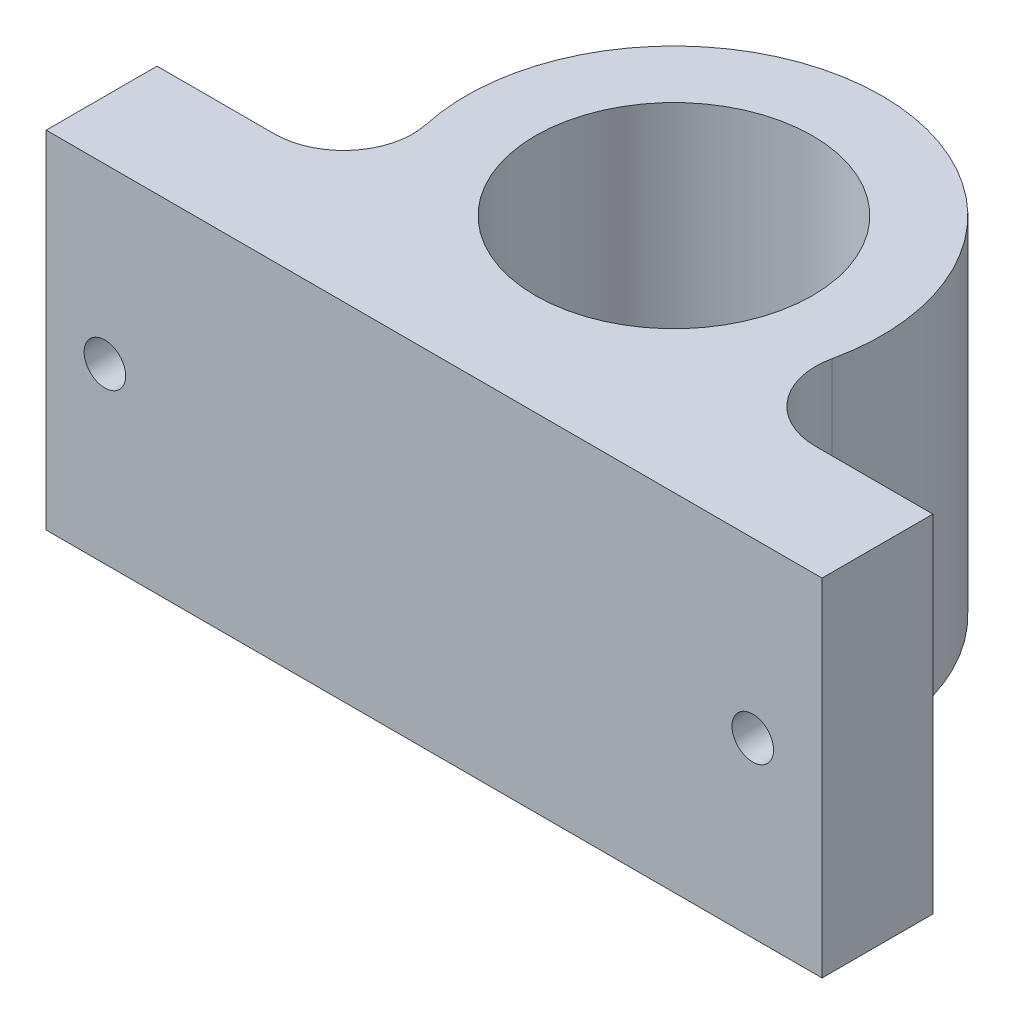
from build123d import *

# Parameters (mm, degrees)
SKETCH1_R                 = 10
BOSS_EXTRUDE1_DEPTH       = 25
FILLET2_R                 = 5
FILLET3_R                 = 5
F_3_0MM_DOWEL_HOLE1_D     = 3
F_3_0MM_DOWEL_HOLE1_DEPTH = 12.4
F_3_0MM_DOWEL_HOLE1_TIP   = 0.901290929


with BuildPart() as part:
    # Sketch1 → Boss-Extrude1 (new body)
    with BuildSketch(Plane(origin=(0, 0, 0), x_dir=(1, 0, 0), z_dir=(0, 1, 0))):
        with BuildLine():
            Line((0, 0), (-28, 0))
            Line((-28, 0), (-28, 8))
            Line((-28, 8), (-11.761010247, 8))
            ThreePointArc((-11.761010247, 8), (0, 32.310136302), (11.761010247, 8))
            Line((11.761010247, 8), (28, 8))
            Line((28, 8), (28, 0))
            Line((28, 0), (0, 0))
        make_face()
        with Locations(Location((0, 17.310136302, 0), (0, 0, 270))):
            Circle(SKETCH1_R, mode=Mode.SUBTRACT)
    extrude(amount=BOSS_EXTRUDE1_DEPTH)

    # Fillet2
    fillet2_edges = [part.edges().sort_by_distance(p)[0] for p in [
        (11.761010247, 12.5, -8),
    ]]
    fillet(fillet2_edges, radius=FILLET2_R)

    # Fillet3
    fillet3_edges = [part.edges().sort_by_distance(p)[0] for p in [
        (-11.761010247, 12.5, -8),
    ]]
    fillet(fillet3_edges, radius=FILLET3_R)

    # Ø3.0mm Dowel Hole1
    with Locations(Plane(origin=(23, 12.5, -8), x_dir=(-1, 0, 0), z_dir=(0, 0, -1))):
        with Locations((0, 0), (46.765023362, 0)):
            Hole(F_3_0MM_DOWEL_HOLE1_D / 2, depth=F_3_0MM_DOWEL_HOLE1_DEPTH)
            with Locations((0, 0, -(F_3_0MM_DOWEL_HOLE1_DEPTH + F_3_0MM_DOWEL_HOLE1_TIP / 2))):  # 118° drill point
                Cone(0, F_3_0MM_DOWEL_HOLE1_D / 2, F_3_0MM_DOWEL_HOLE1_TIP, mode=Mode.SUBTRACT)


solid = part.part
